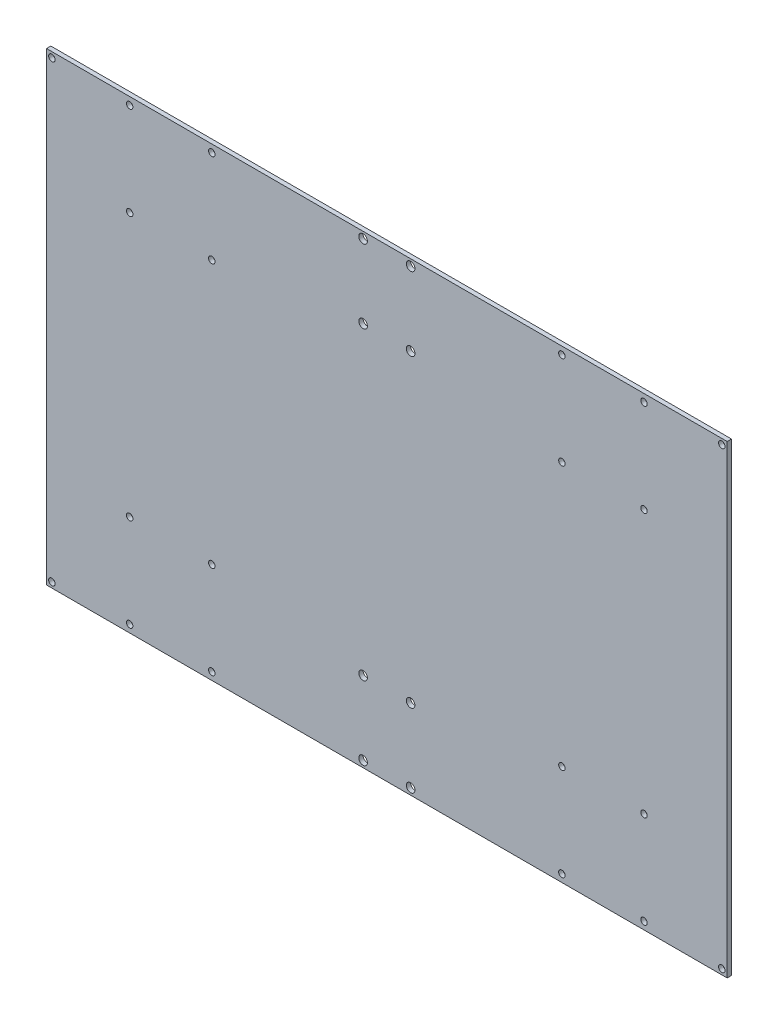
from build123d import *

# Parameters (mm, degrees)
SKETCH_1_W          = 315
SKETCH_1_H          = 215
EXTRUDE_1_DEPTH     = 2
SKETCH_2_R          = 1.5
CUT_EXTRUDE_1_DEPTH = 2
SKETCH_5_R          = 1.5
CUT_EXTRUDE_2_DEPTH = 2
SKETCH_6_R          = 2
CUT_EXTRUDE_3_DEPTH = 2


with BuildPart() as part:
    # 草图1 → 凸台-拉伸1 (new body)
    with BuildSketch(Plane.XY):
        Rectangle(SKETCH_1_W, SKETCH_1_H)
    extrude(amount=EXTRUDE_1_DEPTH)

    # 草图2 → 切除-拉伸1 (cut)
    with BuildSketch(Plane.XY.offset(2)):
        with Locations((-155, 105)):
            Circle(SKETCH_2_R)
        with Locations(Location((155, 105, 0), (0, 0, 180))):
            Circle(SKETCH_2_R)
        with Locations((155, -105)):
            Circle(SKETCH_2_R)
        with Locations(Location((-155, -105, 0), (0, 0, 180))):
            Circle(SKETCH_2_R)
    extrude(amount=-CUT_EXTRUDE_1_DEPTH, mode=Mode.SUBTRACT)

    # 草图5 → 切除-拉伸2 (cut)
    with BuildSketch(Plane.XY.offset(2)):
        with Locations((-119, 104)):
            Circle(SKETCH_5_R)
        with Locations((-81, 104)):
            Circle(SKETCH_5_R)
        with Locations((-119, 61)):
            Circle(SKETCH_5_R)
        with Locations((-81, 61)):
            Circle(SKETCH_5_R)
        with Locations((81, 104)):
            Circle(SKETCH_5_R)
        with Locations((119, 104)):
            Circle(SKETCH_5_R)
        with Locations((119, 61)):
            Circle(SKETCH_5_R)
        with Locations((81, 61)):
            Circle(SKETCH_5_R)
        with Locations((81, -61)):
            Circle(SKETCH_5_R)
        with Locations((119, -61)):
            Circle(SKETCH_5_R)
        with Locations((119, -104)):
            Circle(SKETCH_5_R)
        with Locations((81, -104)):
            Circle(SKETCH_5_R)
        with Locations((-119, -61)):
            Circle(SKETCH_5_R)
        with Locations((-81, -61)):
            Circle(SKETCH_5_R)
        with Locations((-81, -104)):
            Circle(SKETCH_5_R)
        with Locations((-119, -104)):
            Circle(SKETCH_5_R)
    extrude(amount=-CUT_EXTRUDE_2_DEPTH, mode=Mode.SUBTRACT)

    # 草图6 → 切除-拉伸3 (cut)
    with BuildSketch(Plane.XY.offset(2)):
        with Locations((-11, 104.5)):
            Circle(SKETCH_6_R)
        with Locations((11, 104.5)):
            Circle(SKETCH_6_R)
        with Locations((-11, 70.5)):
            Circle(SKETCH_6_R)
        with Locations((11, 70.5)):
            Circle(SKETCH_6_R)
        with Locations((-11, -70.5)):
            Circle(SKETCH_6_R)
        with Locations((11, -70.5)):
            Circle(SKETCH_6_R)
        with Locations((-11, -104.5)):
            Circle(SKETCH_6_R)
        with Locations((11, -104.5)):
            Circle(SKETCH_6_R)
    extrude(amount=-CUT_EXTRUDE_3_DEPTH, mode=Mode.SUBTRACT)


solid = part.part
